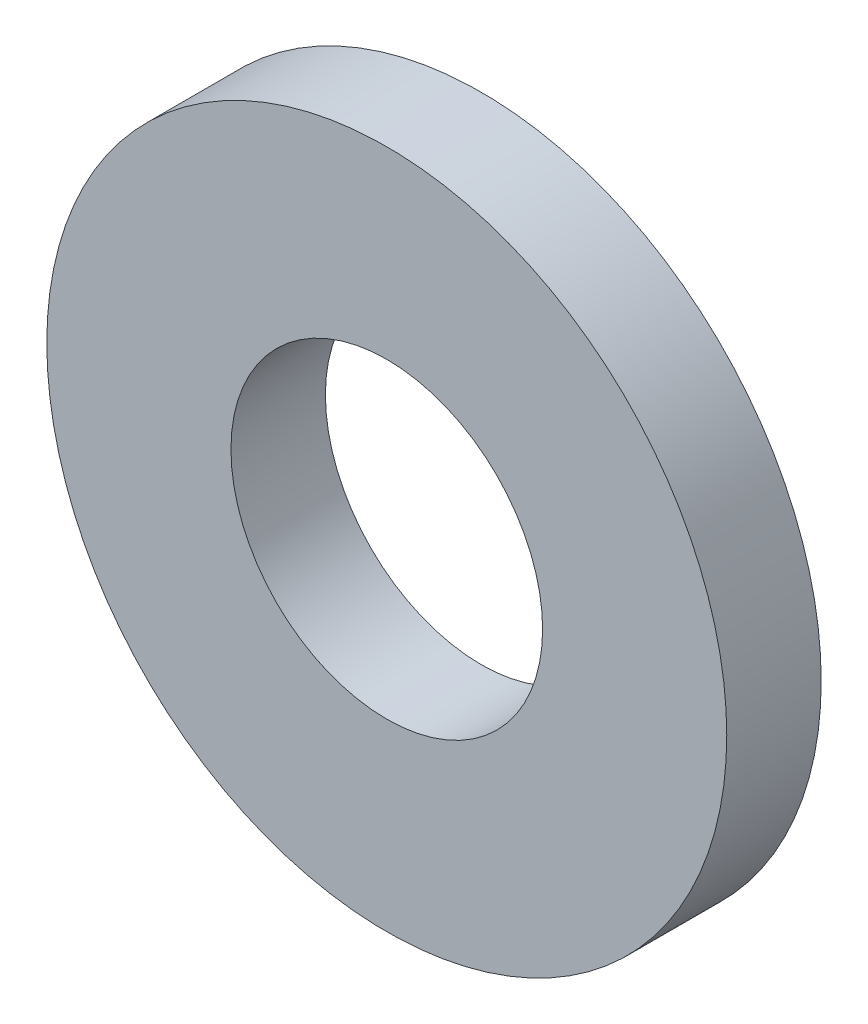
from build123d import *

# Parameters (mm, degrees)
SKETCH2_R           = 3.6
SKETCH2_R_2         = 1.65
BOSS_EXTRUDE1_DEPTH = 1


with BuildPart() as part:
    # Sketch2 → Boss-Extrude1 (new body)
    with BuildSketch(Plane.XY):
        Circle(SKETCH2_R)
        Circle(SKETCH2_R_2, mode=Mode.SUBTRACT)
    extrude(amount=BOSS_EXTRUDE1_DEPTH)


solid = part.part
